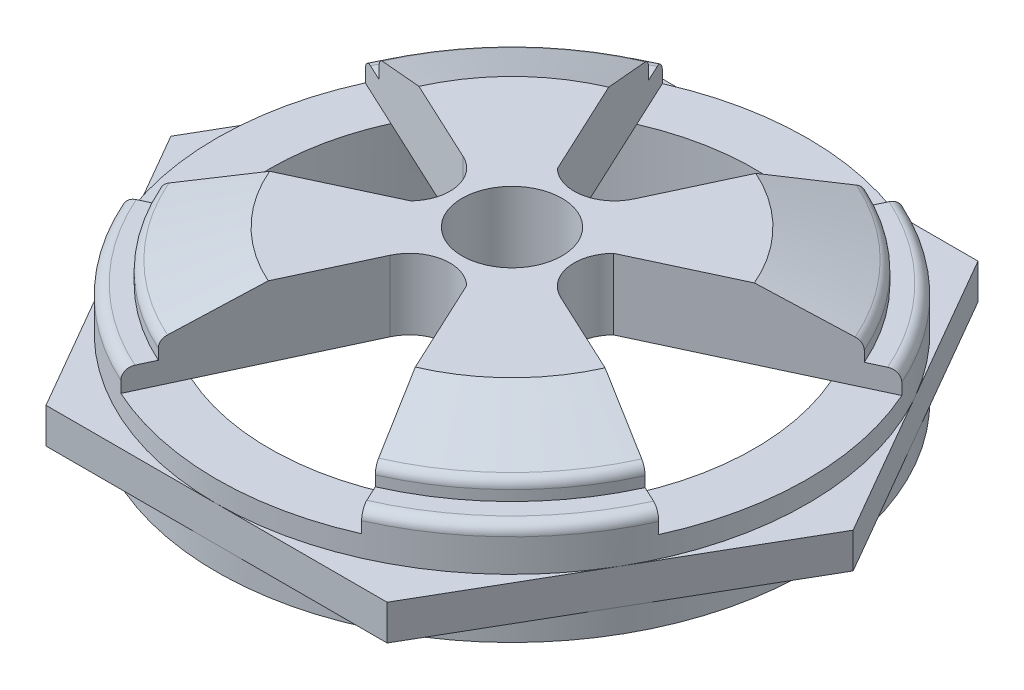
from build123d import *

# Parameters (mm, degrees)
CUT_EXTRUDE1_DEPTH  = 5
CUT_EXTRUDE2_START  = -2.5
CUT_EXTRUDE2_DEPTH  = 2.5
CUT_EXTRUDE3_START  = -5
SKETCH2_3_R         = 17.15
CUT_EXTRUDE3_DEPTH  = 17.2
SKETCH2_4_R         = 3.535533906
CUT_EXTRUDE4_DEPTH  = 39.518956436
BOSS_EXTRUDE1_START = -1.5
BOSS_EXTRUDE1_DEPTH = 2.5


with BuildPart() as part:
    # Sketch1 → Revolve1 (revolve)
    with BuildSketch(Plane.XY, mode=Mode.PRIVATE) as revolve1_sk:
        with BuildLine():
            Line((0, 12.35), (0, -12.35))
            Line((0, -12.35), (-18.904240623, -12.35))
            ThreePointArc((-18.904240623, -12.35), (-19.434570709, -12.130330086), (-19.654240623, -11.6))
            Line((-19.654240623, -11.6), (-19.654240623, -11.1))
            Line((-19.654240623, -11.1), (-20.9, -11.1))
            Line((-20.9, -11.1), (-20.9, 8.15))
            ThreePointArc((-20.9, 8.15), (-20.680330086, 8.680330086), (-20.15, 8.9))
            Line((-20.15, 8.9), (-18.904240623, 8.9))
            Line((-18.904240623, 8.9), (-18.904240623, 9.630769231))
            ThreePointArc((-18.904240623, 9.630769231), (-18.770884767, 10.057676715), (-18.418240623, 10.332769231))
            Line((-18.418240623, 10.332769231), (-13.054240623, 12.35))
            Line((-13.054240623, 12.35), (0, 12.35))
        make_face()
    revolve(revolve1_sk.sketch.rotate(Axis((0, -1000, 0), (0, 1, 0)), 180), axis=Axis((0, -1000, 0), (0, 1, 0)))

    # Sketch2 → Cut-Extrude1 (cut)
    with BuildSketch(Plane(origin=(0, 12.35, 0), x_dir=(1, 0, 0), z_dir=(0, 1, 0))):
        with BuildLine():
            Line((-8.470268029, 19.1066627), (-1.978678793, 5.185404659))
            ThreePointArc((-1.978678793, 5.185404659), (0.526465099, 4.43920684), (2.591742961, 6.041450409))
            Line((2.591742961, 6.041450409), (8.647131476, 19.027272985))
            ThreePointArc((8.647131476, 19.027272985), (0.0969322, 20.899775218), (-8.470268029, 19.1066627))
        make_face()
        with BuildLine():
            Line((19.1066627, 8.470268029), (5.185404659, 1.978678793))
            ThreePointArc((5.185404659, 1.978678793), (4.43920684, -0.526465099), (6.041450409, -2.591742961))
            Line((6.041450409, -2.591742961), (19.027272985, -8.647131476))
            ThreePointArc((19.027272985, -8.647131476), (20.899775218, -0.0969322), (19.1066627, 8.470268029))
        make_face()
        with BuildLine():
            Line((8.470268029, -19.1066627), (1.978678793, -5.185404659))
            ThreePointArc((1.978678793, -5.185404659), (-0.526465099, -4.43920684), (-2.591742961, -6.041450409))
            Line((-2.591742961, -6.041450409), (-8.647131476, -19.027272985))
            ThreePointArc((-8.647131476, -19.027272985), (-0.0969322, -20.899775218), (8.470268029, -19.1066627))
        make_face()
        with BuildLine():
            Line((-19.1066627, -8.470268029), (-5.185404659, -1.978678793))
            ThreePointArc((-5.185404659, -1.978678793), (-4.43920684, 0.526465099), (-6.041450409, 2.591742961))
            Line((-6.041450409, 2.591742961), (-19.027272985, 8.647131476))
            ThreePointArc((-19.027272985, 8.647131476), (-20.899775218, 0.0969322), (-19.1066627, -8.470268029))
        make_face()
    extrude(amount=-CUT_EXTRUDE1_DEPTH, mode=Mode.SUBTRACT)

    # Sketch4 → Cut-Extrude2 (cut)
    with BuildSketch(Plane.XZ.offset(12.35).offset(CUT_EXTRUDE2_START)):
        with BuildLine():
            Line((19.750543614, 6.835643858), (6.391971098, 2.365928018))
            ThreePointArc((6.391971098, 2.365928018), (4.733487025, -0.031487028), (6.451436213, -2.386655581))
            Line((6.451436213, -2.386655581), (19.750285899, -6.836388441))
            ThreePointArc((19.750285899, -6.836388441), (20.899999996, -0.000393961), (19.750543614, 6.835643858))
        make_face()
        with BuildLine():
            Line((-6.835643858, 19.750543614), (-2.365928018, 6.391971098))
            ThreePointArc((-2.365928018, 6.391971098), (0.031487028, 4.733487025), (2.386655581, 6.451436213))
            Line((2.386655581, 6.451436213), (6.836388441, 19.750285899))
            ThreePointArc((6.836388441, 19.750285899), (0.000393961, 20.899999996), (-6.835643858, 19.750543614))
        make_face()
        with BuildLine():
            Line((6.835643858, -19.750543614), (2.365928018, -6.391971098))
            ThreePointArc((2.365928018, -6.391971098), (-0.031487028, -4.733487025), (-2.386655581, -6.451436213))
            Line((-2.386655581, -6.451436213), (-6.836388441, -19.750285899))
            ThreePointArc((-6.836388441, -19.750285899), (-0.000393961, -20.899999996), (6.835643858, -19.750543614))
        make_face()
        with BuildLine():
            Line((-19.750543614, -6.835643858), (-6.391971098, -2.365928018))
            ThreePointArc((-6.391971098, -2.365928018), (-4.733487025, 0.031487028), (-6.451436213, 2.386655581))
            Line((-6.451436213, 2.386655581), (-19.750285899, 6.836388441))
            ThreePointArc((-19.750285899, 6.836388441), (-20.899999996, 0.000393961), (-19.750543614, -6.835643858))
        make_face()
    extrude(amount=CUT_EXTRUDE2_DEPTH, mode=Mode.SUBTRACT)

    # Sketch2<3> → Cut-Extrude3 (cut)
    with BuildSketch(Plane(origin=(0, 12.35, 0), x_dir=(1, 0, 0), z_dir=(0, 1, 0)).offset(CUT_EXTRUDE3_START)):
        with Locations(Location((0, 0, 0), (0, 0, 160.780147913))):
            Circle(SKETCH2_3_R)
    extrude(amount=-CUT_EXTRUDE3_DEPTH, mode=Mode.SUBTRACT)

    # Sketch2<4> → Cut-Extrude4 (cut, through all)
    with BuildSketch(Plane(origin=(0, 12.35, 0), x_dir=(1, 0, 0), z_dir=(0, 1, 0))):
        with Locations(Location((0, 0, 0), (0, 0, 180))):
            Circle(SKETCH2_4_R)
    extrude(amount=-CUT_EXTRUDE4_DEPTH, mode=Mode.SUBTRACT)

    # Sketch5 → Boss-Extrude1 (add)
    with BuildSketch(Plane(origin=(0, 7.35, 0), x_dir=(1, 0, 0), z_dir=(0, 1, 0)).offset(BOSS_EXTRUDE1_START)):
        Polygon((12.066620626, 20.9), (-12.066620626, 20.9), (-24.133241252, 0), (-12.066620626, -20.9), (12.066620626, -20.9), (24.133241252, 0), align=None)
        with BuildLine():
            ThreePointArc((-19.1066627, -8.470268029), (-20.899775218, 0.0969322), (-19.027272985, 8.647131476))
            Line((-19.027272985, 8.647131476), (-17.078607454, 7.738453815))
            ThreePointArc((-17.078607454, 7.738453815), (3.958447312, 18.3273892), (18.75, 0))
            ThreePointArc((18.75, 0), (3.863644604, -18.347608846), (-17.157706707, -7.561454924))
            Line((-17.157706707, -7.561454924), (-19.1066627, -8.470268029))
        make_face(mode=Mode.SUBTRACT)
    extrude(amount=-BOSS_EXTRUDE1_DEPTH)

    # SurfaceCut1
    split(bisect_by=Plane(origin=(0, 1.675, 0), x_dir=(1, 0, 0), z_dir=(0, 1, 0)), keep=Keep.TOP)


solid = part.part
